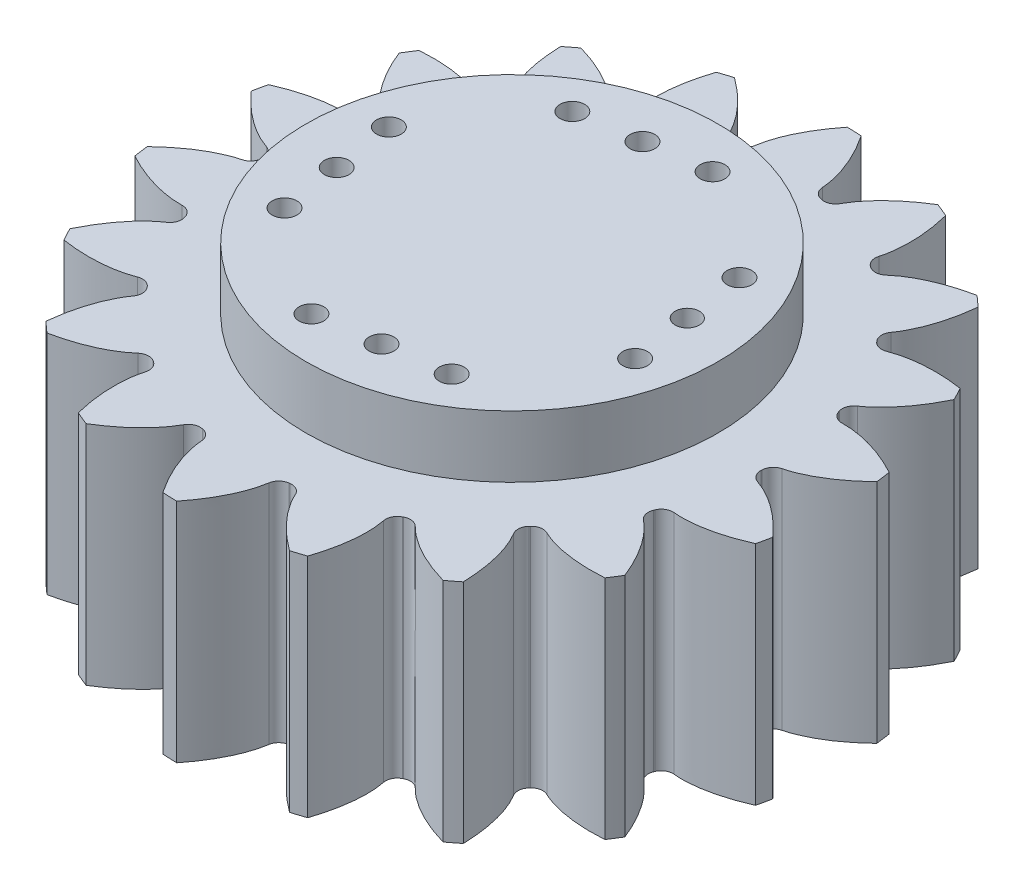
from build123d import *

# Parameters (mm, degrees)
ESQUISSE1_R                        = 16
BOSS_EXTRU_1_DEPTH                 = 11
ENL_V_MAT_EXTRU_1_DEPTH            = 26.159491251
CONG_1_R                           = 0.57
R_P_TITION_CIRCULAIRE1_COUNT       = 18
CONG_1_OF_R_P_TITION_CIRCULAIRE1_R = 0.57
ESQUISSE6_R                        = 4
ESQUISSE6_R_2                      = 1.2
ENL_V_MAT_EXTRU_2_DEPTH            = 26.092836321
SKETCH1_R                          = 10
BOSS_EXTRUDE1_DEPTH                = 3
SKETCH3_R                          = 0.6
SKETCH3_R_2                        = 0.587536397
CUT_EXTRUDE2_DEPTH                 = 3


with BuildPart() as part:
    # Esquisse1 → Boss.-Extru.1 (new body)
    with BuildSketch(Plane(origin=(0, 0, 0), x_dir=(1, 0, 0), z_dir=(0, 1, 0))):
        with Locations(Location((0, 0, 0), (0, 0, 270))):
            Circle(ESQUISSE1_R)
    extrude(amount=BOSS_EXTRU_1_DEPTH)

    # Esquisse5 → Enlèv. mat.-Extru.1 (cut, symmetric)
    with BuildSketch(Plane(origin=(0, 0, 0), x_dir=(1, 0, 0), z_dir=(0, 1, 0))):
        with BuildLine():
            add(Edge.make_bspline(
                [(12.685850381, 0), (12.69522907, 0.00019847), (12.721513502, 0.001369319), (12.771095723, 0.006007086), (12.851667315, 0.017005792), (12.953705597, 0.036042512), (13.084625834, 0.066377448), (13.237381246, 0.10942845), (13.403418578, 0.164334622), (13.581780638, 0.232170805), (13.757479313, 0.30693713), (13.930450016, 0.388032644), (14.10054883, 0.474640612), (14.30376747, 0.58632283), (14.543374477, 0.72960052), (14.816941976, 0.910379418), (15.119104585, 1.130887572), (15.417626931, 1.371627533), (15.646317848, 1.571622422), (15.80077072, 1.715986573), (15.883563281, 1.795692636), (15.897397379, 1.809076162)],
                knots=[0, 0, 0, 0, 0, 0.005376748, 0.015083688, 0.02853182, 0.046610139, 0.064854849, 0.092110525, 0.119476175, 0.146842495, 0.174208853, 0.201574955, 0.228941013, 0.256307345, 0.307035032, 0.361767351, 0.41649966, 0.471231936, 0.525964281, 0.536985928, 0.536985928, 0.536985928, 0.536985928, 0.536985928], degree=4))
            Line((12.685850381, 0), (12.625, 0))
            ThreePointArc((12.625, 0), (12.615264878, -0.495698552), (12.586074526, -0.990632638))
            Line((12.586074526, -0.990632638), (12.646737292, -0.995407321))
            add(Edge.make_bspline(
                [(12.646737292, -0.995407321), (12.656071493, -0.996341086), (12.682183012, -0.999570759), (12.731248454, -1.008084743), (12.810708603, -1.025371665), (12.910938546, -1.052356221), (13.039074869, -1.092870409), (13.187981267, -1.147774775), (13.349198407, -1.215539937), (13.52168771, -1.297162316), (13.690978058, -1.385484484), (13.85705222, -1.479902275), (14.019830808, -1.579590178), (14.213659632, -1.706873801), (14.44128546, -1.868510728), (14.699824507, -2.070197981), (14.983753104, -2.313735741), (15.262465154, -2.57715729), (15.47475818, -2.794480004), (15.617407172, -2.950518343), (15.693690254, -3.036475052), (15.706431548, -3.05090282)],
                knots=[0, 0, 0, 0, 0, 0.005376748, 0.015083688, 0.02853182, 0.046610139, 0.064854849, 0.092110525, 0.119476175, 0.146842495, 0.174208853, 0.201574955, 0.228941013, 0.256307345, 0.307035032, 0.361767351, 0.41649966, 0.471231936, 0.525964281, 0.536985928, 0.536985928, 0.536985928, 0.536985928, 0.536985928], degree=4))
            ThreePointArc((15.706431548, -3.05090282), (15.926438785, -1.532497182), (16, 0))
            ThreePointArc((16, 0), (15.974328751, 0.905991702), (15.897397379, 1.809076162))
        make_face()
    enl_v_mat_extru_1 = extrude(amount=ENL_V_MAT_EXTRU_1_DEPTH, both=True, mode=Mode.SUBTRACT)

    # Congé1
    cong_1_edges = [part.edges().sort_by_distance(p)[0] for p in [
        (12.586074526, 5.5, 0.990632638),
        (12.625, 5.5, 0),
    ]]
    fillet(cong_1_edges, radius=CONG_1_R)

    # Répétition circulaire1: Enlèv. mat.-Extru.1 ×18 about axis
    r_p_tition_circulaire1_axis = Axis((0, 11, 0), (0, 1, 0))
    for i in range(1, R_P_TITION_CIRCULAIRE1_COUNT):
        add(enl_v_mat_extru_1.rotate(r_p_tition_circulaire1_axis, i * 360 / R_P_TITION_CIRCULAIRE1_COUNT), mode=Mode.SUBTRACT)

    # Congé1 of Répétition circulaire1
    cong_1_of_r_p_tition_circulaire1_edges = [part.edges().sort_by_distance(p)[0] for p in [
        (12.165857674, 5.5, -3.373800833),
        (11.863619337, 5.5, -4.318004309),
        (10.278258837, 5.5, -7.331304132),
        (9.671311094, 5.5, -8.115193572),
        (7.150950293, 5.5, -10.404543954),
        (6.3125, 5.5, -10.933570723),
        (3.161131608, 5.5, -12.222842221),
        (2.192308243, 5.5, -12.433197882),
        (-1.209966203, 5.5, -12.566885326),
        (-2.192308243, 5.5, -12.433197882),
        (-5.435124233, 5.5, -11.395176593),
        (-6.3125, 5.5, -10.933570723),
        (-9.004726066, 5.5, -8.849041388),
        (-9.671311094, 5.5, -8.115193572),
        (-11.48822504, 5.5, -5.235581193),
        (-11.863619337, 5.5, -4.318004309),
        (-12.586074526, 5.5, -0.990632638),
        (-12.625, 5.5, 0),
        (-12.165857674, 5.5, 3.373800833),
        (-11.863619337, 5.5, 4.318004309),
        (-10.278258837, 5.5, 7.331304132),
        (-9.671311094, 5.5, 8.115193572),
        (-7.150950293, 5.5, 10.404543954),
        (-6.3125, 5.5, 10.933570723),
        (-3.161131608, 5.5, 12.222842221),
        (-2.192308243, 5.5, 12.433197882),
        (1.209966203, 5.5, 12.566885326),
        (2.192308243, 5.5, 12.433197882),
        (5.435124233, 5.5, 11.395176593),
        (6.3125, 5.5, 10.933570723),
        (9.004726066, 5.5, 8.849041388),
        (9.671311094, 5.5, 8.115193572),
        (11.48822504, 5.5, 5.235581193),
        (11.863619337, 5.5, 4.318004309),
    ]]
    fillet(cong_1_of_r_p_tition_circulaire1_edges, radius=CONG_1_OF_R_P_TITION_CIRCULAIRE1_R)

    # Esquisse6 → Enlèv. mat.-Extru.2 (cut, through all)
    with BuildSketch(Plane(origin=(0, 11, 0), x_dir=(1, 0, 0), z_dir=(0, 1, 0))):
        with Locations(Location((0, 0, 0), (0, 0, 270))):
            Circle(ESQUISSE6_R)
        with Locations(Location((-8.5, 0, 0), (0, 0, 270))):
            Circle(ESQUISSE6_R_2)
        with Locations(Location((8.5, 0, 0), (0, 0, 270))):
            Circle(ESQUISSE6_R_2)
    extrude(amount=-ENL_V_MAT_EXTRU_2_DEPTH, mode=Mode.SUBTRACT)

    # Sketch1 → Boss-Extrude1 (add)
    with BuildSketch(Plane(origin=(0, 11, 0), x_dir=(1, 0, 0), z_dir=(0, 1, 0))):
        with Locations(Location((0, 0, 0), (0, 0, 270))):
            Circle(SKETCH1_R)
    extrude(amount=BOSS_EXTRUDE1_DEPTH)

    # Sketch3 → Cut-Extrude2 (cut)
    with BuildSketch(Plane(origin=(0, 14, 0), x_dir=(1, 0, 0), z_dir=(0, 1, 0))):
        with Locations(Location((6.985304804, 4.056540002, 0), (0, 0, 270))):
            Circle(SKETCH3_R)
        with Locations(Location((7.420621384, 1.088291449, 0), (0, 0, 270))):
            Circle(SKETCH3_R_2)
        with Locations(Location((7.855937963, -1.879957105, 0), (0, 0, 270))):
            Circle(SKETCH3_R)
        with Locations(Location((1.879957105, 7.855937963, 0), (0, 0, 270))):
            Circle(SKETCH3_R)
        with Locations(Location((-1.088291449, 7.420621384, 0), (0, 0, 270))):
            Circle(SKETCH3_R)
        with Locations(Location((-4.056540002, 6.985304804, 0), (0, 0, 270))):
            Circle(SKETCH3_R)
        with Locations(Location((-7.855937963, 1.879957105, 0), (0, 0, 270))):
            Circle(SKETCH3_R)
        with Locations(Location((-7.420621384, -1.088291449, 0), (0, 0, 270))):
            Circle(SKETCH3_R)
        with Locations(Location((-6.985304804, -4.056540002, 0), (0, 0, 270))):
            Circle(SKETCH3_R)
        with Locations(Location((-1.879957105, -7.855937963, 0), (0, 0, 270))):
            Circle(SKETCH3_R)
        with Locations(Location((1.088291449, -7.420621384, 0), (0, 0, 270))):
            Circle(SKETCH3_R)
        with Locations(Location((4.056540002, -6.985304804, 0), (0, 0, 270))):
            Circle(SKETCH3_R)
    extrude(amount=-CUT_EXTRUDE2_DEPTH, mode=Mode.SUBTRACT)


solid = part.part
